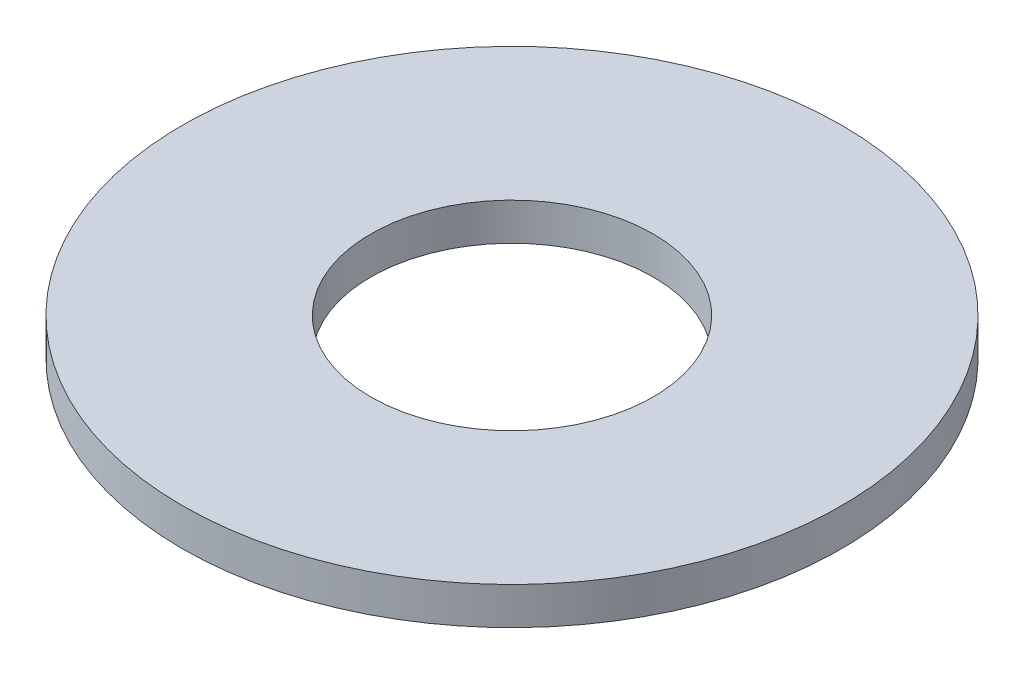
from build123d import *

# Parameters (mm, degrees)
SKETCH1_R           = 7
SKETCH1_R_2         = 3
BOSS_EXTRUDE1_DEPTH = 0.79375


with BuildPart() as part:
    # Sketch1 → Boss-Extrude1 (new body)
    with BuildSketch(Plane(origin=(0, 0, 0), x_dir=(1, 0, 0), z_dir=(0, 1, 0))):
        with Locations(Location((0, 0, 0), (0, 0, 270))):
            Circle(SKETCH1_R)
        with Locations(Location((0, 0, 0), (0, 0, 270))):
            Circle(SKETCH1_R_2, mode=Mode.SUBTRACT)
    extrude(amount=BOSS_EXTRUDE1_DEPTH)


solid = part.part
